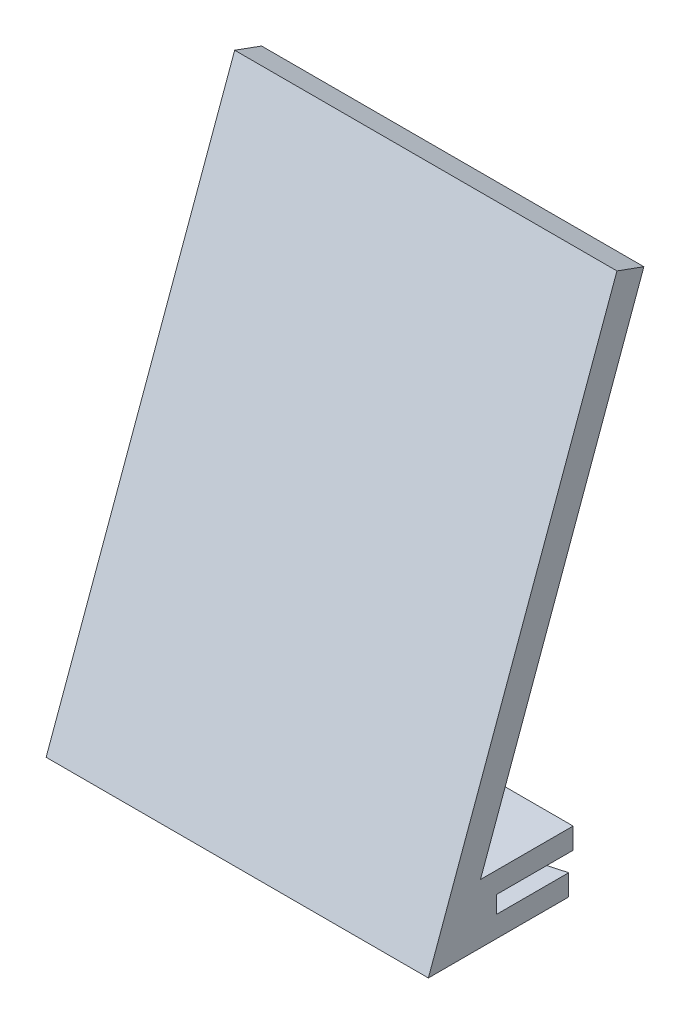
from build123d import *

# Parameters (mm, degrees)
CROQUIS1_W                = 20
CROQUIS1_H                = 1.1
SALIENTE_EXTRUIR1_DEPTH   = 4
SALIENTE_EXTRUIR1_2_DEPTH = 4
CORTAR_EXTRUIR1_DEPTH     = 1.1
SALIENTE_EXTRUIR2_DEPTH   = 20


with BuildPart() as part:
    # Croquis1 → Saliente-Extruir1 (new body)
    with BuildSketch(Plane.XY):
        with Locations((-2.668808514, -79.450421588)):
            Rectangle(CROQUIS1_W, CROQUIS1_H)
    extrude(amount=-SALIENTE_EXTRUIR1_DEPTH)

    # Croquis2 → Cortar-Extruir1 (cut)
    with BuildSketch(Plane.XZ.offset(80.000421588)):
        Polygon((8.185712697, -4), (-2.668808514, -1.066345619), (-13.523329725, -4), align=None)
    extrude(amount=-CORTAR_EXTRUIR1_DEPTH, mode=Mode.SUBTRACT)



with BuildPart() as body_2:
    # Croquis1 → Saliente-Extruir1 2 (new body)
    with BuildSketch(Plane.XY):
        with Locations((-2.668808514, -77.450421588)):
            Rectangle(CROQUIS1_W, CROQUIS1_H)
    extrude(amount=-SALIENTE_EXTRUIR1_2_DEPTH)


with BuildPart() as part_1:
    add(part.part)

    add(body_2.part)  # Saliente-Extruir2 merges body 2
    # Croquis3 → Saliente-Extruir2 (add, through all)
    with BuildSketch(Plane(origin=(7.331191486, 0, 0), x_dir=(0, 0, -1), z_dir=(1, 0, 0))):
        Polygon((0, -76.900421588), (0, -80.000421588), (-3.57176217, -80.000421588), (6.293776867, -52.895075854), (7.703315798, -53.408106069), (-0.847187785, -76.900421588), align=None)
    extrude(amount=-SALIENTE_EXTRUIR2_DEPTH)


solid = part_1.part
